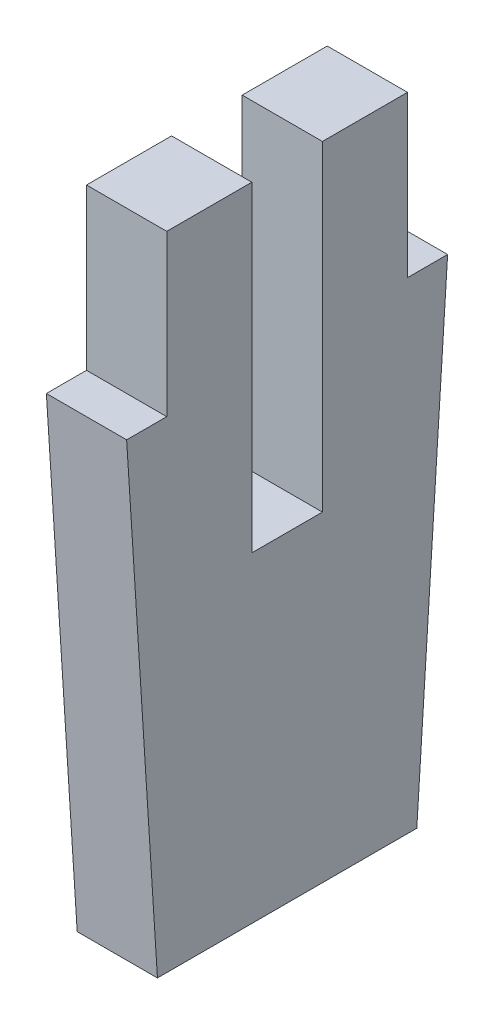
from build123d import *

# Parameters (mm, degrees)
BOSS_EXTRUDE1_DEPTH = 6.35


with BuildPart() as part:
    # Sketch1 → Boss-Extrude1 (new body)
    with BuildSketch(Plane(origin=(0, 0, 0), x_dir=(0, 0, -1), z_dir=(1, 0, 0))):
        Polygon((0, 50.8), (6.731, 50.8), (6.731, 25.4), (12.319, 25.4), (12.319, 50.8), (19.05, 50.8), (19.05, 38.1), (22.225, 38.1), (20.193, 6.35), (19.7866, 0), (-0.7366, 0), (-1.143, 6.35), (-3.175, 38.1), (0, 38.1), align=None)
    extrude(amount=BOSS_EXTRUDE1_DEPTH)


solid = part.part
